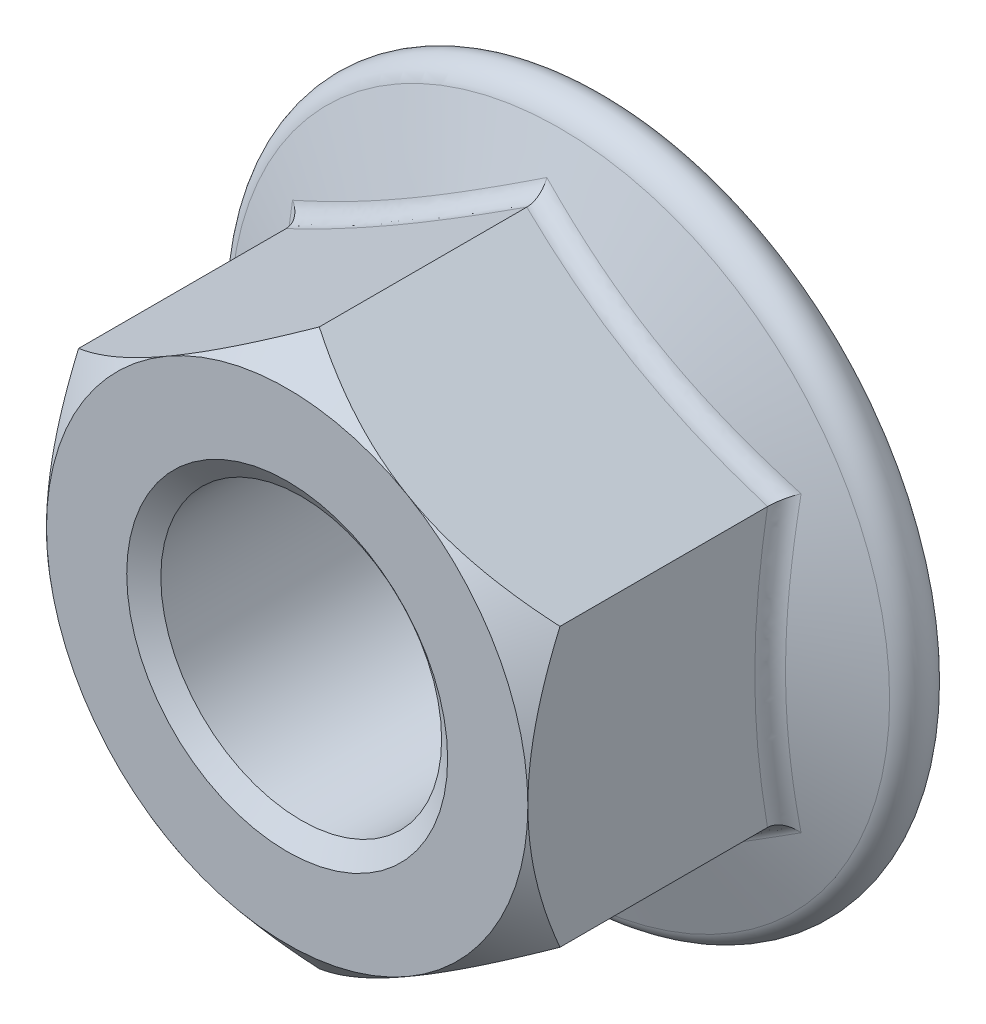
from build123d import *

# Parameters (mm, degrees)
BASENUTSKE_R   = 7
BASENUT_DEPTH  = 16
FLANGEFILLET_R = 0.96


with BuildPart() as part:
    # BaseNutSke → BaseNut (new body)
    with BuildSketch(Plane.XY):
        Polygon((12, 6.92820323), (12, -6.92820323), (0, -13.856406461), (-12, -6.92820323), (-12, 6.92820323), (0, 13.856406461), align=None)
        Circle(BASENUTSKE_R, mode=Mode.SUBTRACT)
    extrude(amount=-BASENUT_DEPTH)

    # Sketch6 → Flange (revolve)
    with BuildSketch(Plane(origin=(0, 0, 0), x_dir=(0, 0, -1), z_dir=(1, 0, 0)), mode=Mode.PRIVATE) as flange_sk:
        with BuildLine():
            Line((10.165622253, 7), (13.6, 16.435875309))
            ThreePointArc((13.6, 16.435875309), (14.977547085, 17.231202489), (16, 16.012690555))
            Line((16, 16.012690555), (16, 7))
            Line((16, 7), (10.165622253, 7))
        make_face()
    revolve(flange_sk.sketch.rotate(Axis((0, 0, 0), (0, 0, -1)), 90), axis=Axis((0, 0, 0), (0, 0, -1)))

    # Sketch3 → Double-Chamfer (revolve, cut)
    with BuildSketch(Plane(origin=(0, 0, 0), x_dir=(0, 0, -1), z_dir=(1, 0, 0)), mode=Mode.PRIVATE) as double_chamfer_sk:
        Polygon((1.6, 26.556406461), (-12.7, 26.556406461), (-12.7, 12), (0, 12), (1.6, 13.856406461), align=None)
    revolve(double_chamfer_sk.sketch.rotate(Axis((0, 0, 0), (0, 0, -1)), 90), axis=Axis((0, 0, 0), (0, 0, -1)), mode=Mode.SUBTRACT)

    # FlangeFillet
    flangefillet_edges = [part.edges().sort_by_distance(p)[0] for p in [
        (12, -3.479213152, -12.16534592),
        (12, 3.479213152, -12.16534592),
        (6, -10.392304845, -11.985473425),
        (6, 10.392304845, -11.985473425),
        (-6, 10.392304845, -11.985473425),
        (-12, 0, -11.985473425),
        (-6, -10.392304845, -11.985473425),
    ]]
    fillet(flangefillet_edges, radius=FLANGEFILLET_R)

    # Sketch5 (on Right Plane) → EndChamfer (revolve, cut)
    with BuildSketch(Plane(origin=(0, 0, 0), x_dir=(0, 0, -1), z_dir=(1, 0, 0)), mode=Mode.PRIVATE) as endchamfer_sk:
        Polygon((15.9746, 8), (15.204371708, 6.9), (16.0254, 6.9), (16.0254, 8), align=None)
        Polygon((-0.0508, 8), (0, 8), (0.770228292, 6.9), (-0.0508, 6.9), align=None)
    revolve(endchamfer_sk.sketch.rotate(Axis((0, 0, -25.037505729), (0, 0, -1)), 90), axis=Axis((0, 0, -25.037505729), (0, 0, -1)), mode=Mode.SUBTRACT)


solid = part.part
